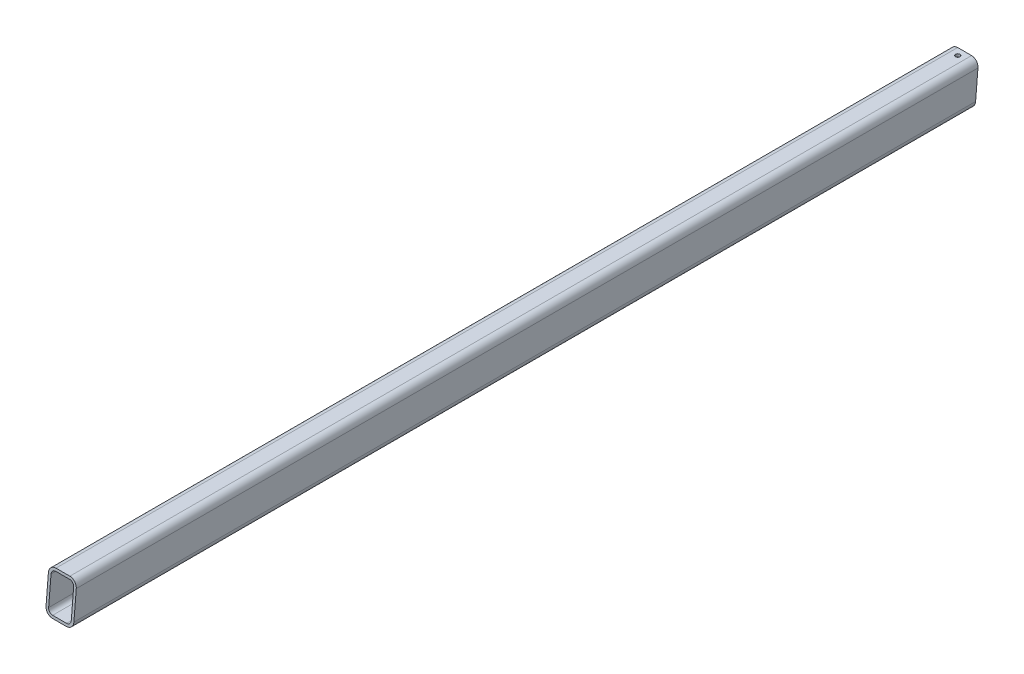
from build123d import *

# Parameters (mm, degrees)
BASE_EXTRUDE_DEPTH = 838.2
CUT_EXTRUDE1_DEPTH = 38.1
SKETCH5_R          = 3.9751
CUT_EXTRUDE3_DEPTH = 827.640765765
SKETCH6_R          = 3.9751
CUT_EXTRUDE4_DEPTH = 827.640765765


with BuildPart() as part:
    # Sketch1 → Base-Extrude (new, symmetric)
    with BuildSketch(Plane.XY):
        with BuildLine():
            Line((-12.7, 38.1), (12.7, 38.1))
            ThreePointArc((12.7, 38.1), (21.680256121, 34.380256121), (25.4, 25.4))
            Line((25.4, 25.4), (25.4, -25.4))
            ThreePointArc((25.4, -25.4), (21.680256121, -34.380256121), (12.7, -38.1))
            Line((12.7, -38.1), (-12.7, -38.1))
            ThreePointArc((-12.7, -38.1), (-21.680256121, -34.380256121), (-25.4, -25.4))
            Line((-25.4, -25.4), (-25.4, 25.4))
            ThreePointArc((-25.4, 25.4), (-21.680256121, 34.380256121), (-12.7, 38.1))
        make_face()
        with BuildLine():
            Line((-20.6248, 25.4), (-20.6248, -25.4))
            ThreePointArc((-20.6248, -25.4), (-18.30367982, -31.00367982), (-12.7, -33.3248))
            Line((-12.7, -33.3248), (12.7, -33.3248))
            ThreePointArc((12.7, -33.3248), (18.30367982, -31.00367982), (20.6248, -25.4))
            Line((20.6248, -25.4), (20.6248, 25.4))
            ThreePointArc((20.6248, 25.4), (18.30367982, 31.00367982), (12.7, 33.3248))
            Line((12.7, 33.3248), (-12.7, 33.3248))
            ThreePointArc((-12.7, 33.3248), (-18.30367982, 31.00367982), (-20.6248, 25.4))
        make_face(mode=Mode.SUBTRACT)
    extrude(amount=BASE_EXTRUDE_DEPTH, both=True)

    # Sketch2 → Cut-Extrude1 (cut, symmetric)
    with BuildSketch(Plane(origin=(0, 0, 0), x_dir=(0, 0, -1), z_dir=(1, 0, 0))):
        Polygon((-811.795200446, 121.113483343), (-832.45021311, -121.113483343), (-857.85021311, -121.113483343), (-857.85021311, 121.113483343), align=None)
        Polygon((833.122276443, 128.994953344), (811.123137113, -128.994953344), (858.522276443, -128.994953344), (858.522276443, 128.994953344), align=None)
    extrude(amount=CUT_EXTRUDE1_DEPTH, both=True, mode=Mode.SUBTRACT)

    # Sketch5 → Cut-Extrude3 (cut, through all)
    with BuildSketch(Plane(origin=(0, 0, 0), x_dir=(1, 0, 0), z_dir=(0, 1, 0))):
        with Locations(Location((0, 806.45, 0), (0, 0, 270))):
            Circle(SKETCH5_R)
    extrude(amount=-CUT_EXTRUDE3_DEPTH, mode=Mode.SUBTRACT)

    # Sketch6 → Cut-Extrude4 (cut, through all)
    with BuildSketch(Plane(origin=(0, 0, 0), x_dir=(1, 0, 0), z_dir=(0, 1, 0))):
        with Locations(Location((0, 812.8, 0), (0, 0, 90))):
            Circle(SKETCH6_R)
    extrude(amount=CUT_EXTRUDE4_DEPTH, mode=Mode.SUBTRACT)


solid = part.part
